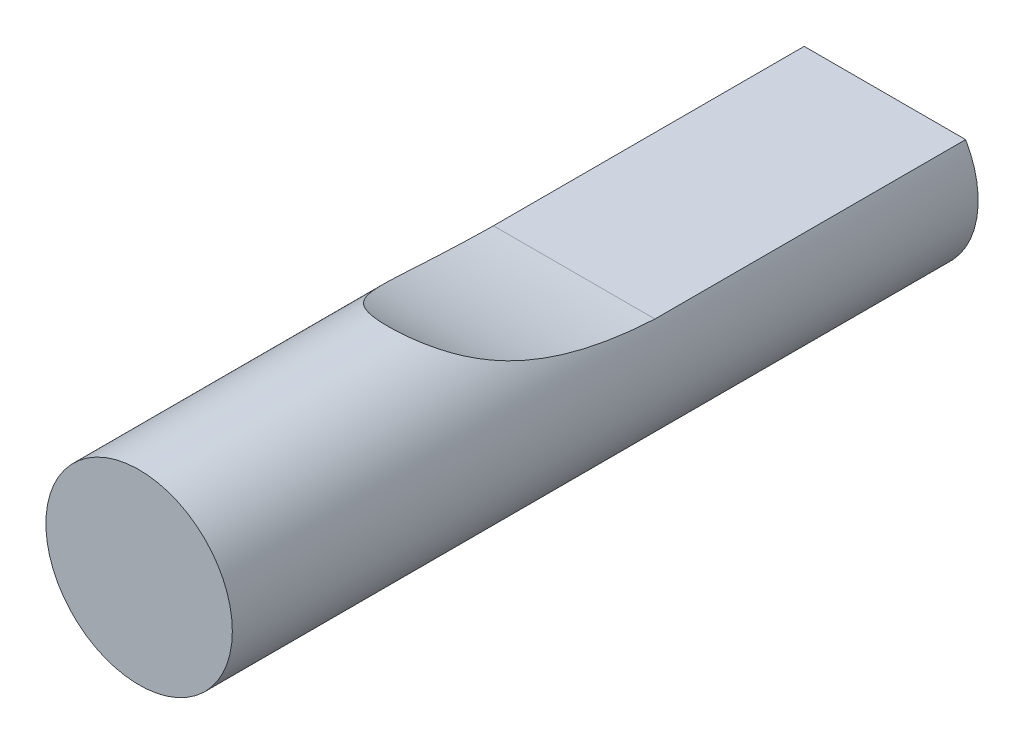
from build123d import *
from build123d.topology import SkipClean

# Parameters (mm, degrees)
BOSS_EXTRU_1_DEPTH      = 5
ESQUISSE2_R             = 1.5
BOSS_EXTRU_2_DEPTH      = 7
ENL_V_MAT_EXTRU_1_DEPTH = 3


with BuildPart() as part:
    # Esquisse1 → Boss.-Extru.1 (new body)
    with BuildSketch(Plane.XY):
        with BuildLine():
            Line((-1.299038106, 0.75), (1.299038106, 0.75))
            ThreePointArc((1.299038106, 0.75), (0, -1.5), (-1.299038106, 0.75))
        make_face()
    extrude(amount=BOSS_EXTRU_1_DEPTH)

    # Esquisse2 → Boss.-Extru.2 (add)
    with SkipClean():  # the faces are left unmerged after this step: merging them gives an invalid solid
        with BuildSketch(Plane.XY.offset(5)):
            with Locations(Location((0, 0, 0), (0, 0, 150))):
                Circle(ESQUISSE2_R)
        extrude(amount=BOSS_EXTRU_2_DEPTH)

    # Esquisse3 → Enlèv. mat.-Extru.1 (cut)
    with SkipClean():  # the faces are left unmerged after this step: merging them gives an invalid solid
        with BuildSketch(Plane(origin=(1.5, 0, 0), x_dir=(0, 0, -1), z_dir=(1, 0, 0))):
            with BuildLine():
                Line((-8, 1.5), (-5, 1.5))
                Line((-5, 1.5), (-5, 0.75))
                add(Edge.make_bspline(
                    [(-8, 1.5), (-6.894526205, 0.811843176), (-5, 0.75)],
                    knots=[0, 0, 0, 0.697141836, 0.697141836, 0.697141836], degree=2))
            make_face()
        extrude(amount=-ENL_V_MAT_EXTRU_1_DEPTH, mode=Mode.SUBTRACT)


solid = part.part
